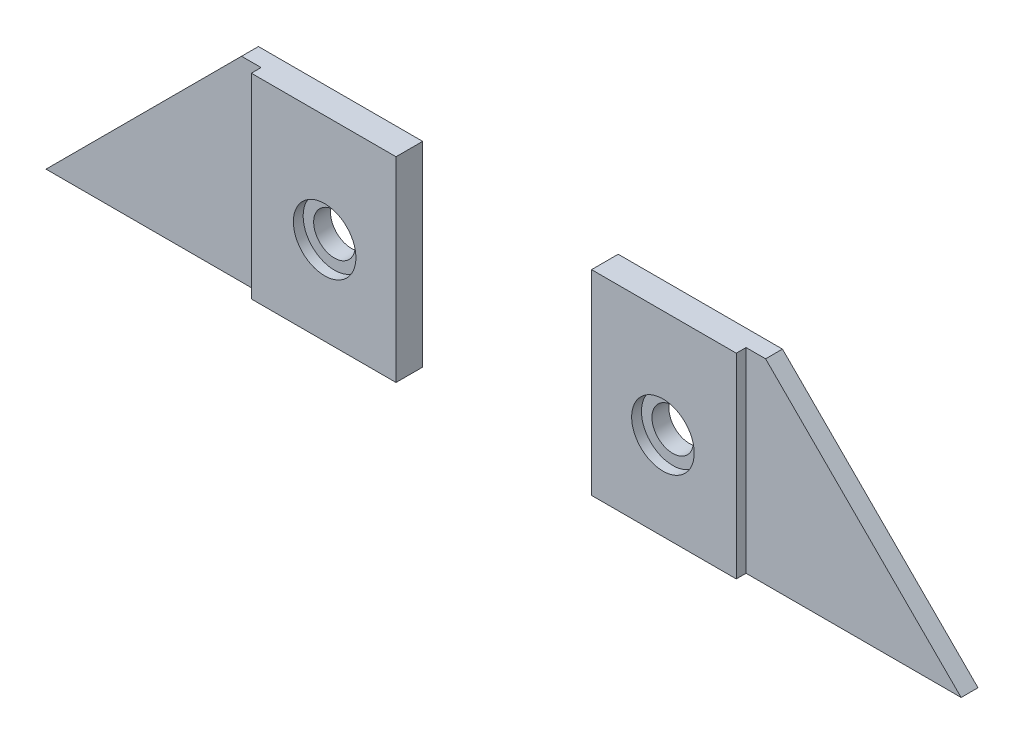
from build123d import *

# Parameters (mm, degrees)
BOSS_EXTRUDE1_DEPTH      = 10
BOSS_EXTRUDE1_DEPTH_BACK = 10
CUT_EXTRUDE1_DEPTH       = 2
SKETCH3_R                = 2.125
CUT_EXTRUDE2_DEPTH       = 3
SKETCH4_R                = 3.2
CUT_EXTRUDE3_DEPTH       = 1


with BuildPart() as part:
    # Sketch1 → Boss-Extrude1 (new, two sides: drawn at the far end of the back side and taken through both)
    with BuildSketch(Plane(origin=(0, 0, 0), x_dir=(1, 0, 0), z_dir=(0, 1, 0)).offset(-BOSS_EXTRUDE1_DEPTH_BACK)):
        Polygon((-18.4, 1.3625), (18.4, 1.3625), (18.4, -0.3625), (-3.6, -0.3625), (-3.6, -1.3625), (-18.4, -1.3625), align=None)
    extrude(amount=BOSS_EXTRUDE1_DEPTH + BOSS_EXTRUDE1_DEPTH_BACK)

    # Sketch2 → Cut-Extrude1 (cut)
    with BuildSketch(Plane.XY.offset(0.3625)):
        Polygon((-1.6, 10), (18.4, -10), (18.4, 10), align=None)
    extrude(amount=-CUT_EXTRUDE1_DEPTH, mode=Mode.SUBTRACT)

    # Sketch3 → Cut-Extrude2 (cut)
    with BuildSketch(Plane.XY.offset(1.3625)):
        with Locations((-11.1, -1)):
            Circle(SKETCH3_R)
    extrude(amount=-CUT_EXTRUDE2_DEPTH, mode=Mode.SUBTRACT)

    # Sketch4 → Cut-Extrude3 (cut)
    with BuildSketch(Plane.XY.offset(1.3625)):
        with Locations((-11.1, -1)):
            Circle(SKETCH4_R)
    extrude(amount=-CUT_EXTRUDE3_DEPTH, mode=Mode.SUBTRACT)


with BuildPart() as body_2:
    # Mirror1: mirrored copy
    add(part.part.mirror(Plane.ZY.offset(28.4)))


solid = Compound([part.part, body_2.part])
